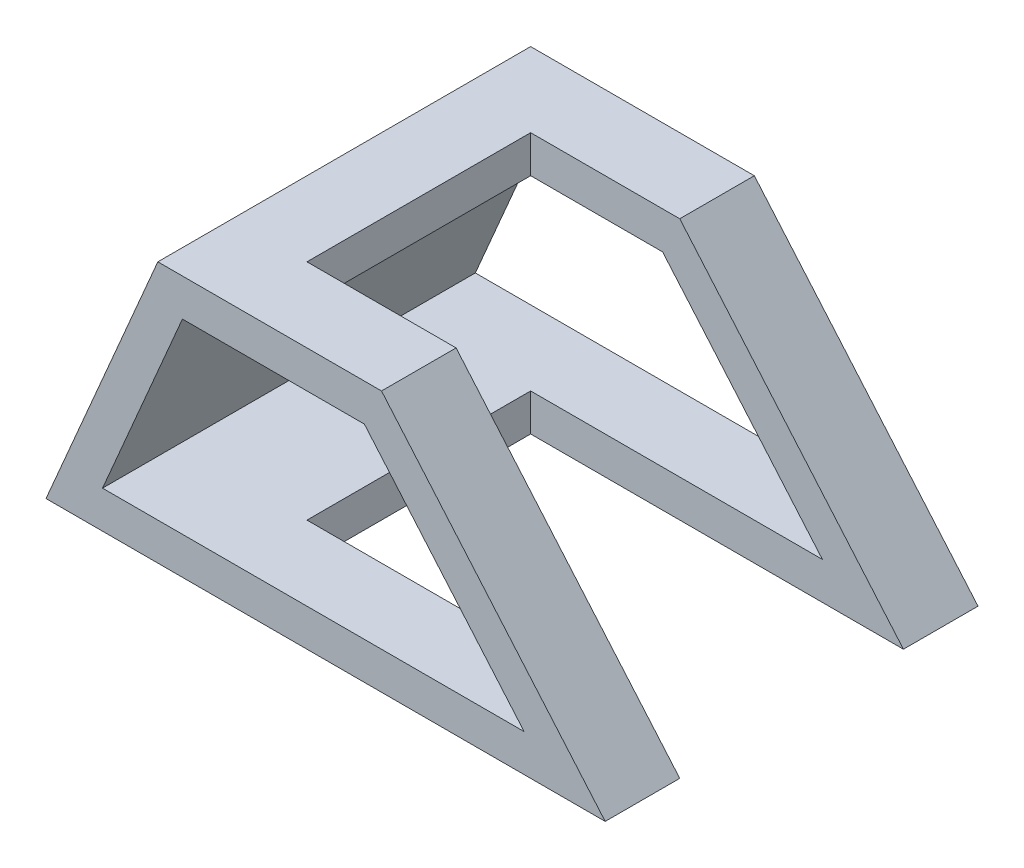
from build123d import *

# Parameters (mm, degrees)
BOSS_EXTRUDE2_DEPTH = 100
SKETCH4_W           = 40
SKETCH4_H           = 60
CUT_EXTRUDE2_DEPTH  = 100
SKETCH6_W           = 60
SKETCH6_H           = 92.195444573
CUT_EXTRUDE4_DEPTH  = 57


with BuildPart() as part:
    # Sketch1 → Boss-Extrude2 (new body)
    with BuildSketch(Plane.XY):
        Polygon((0, 0), (150, 0), (90, 70), (30, 70), align=None)
        Polygon((36.59396158, 60), (15.165390151, 10), (128.257793632, 10), (85.400650775, 60), align=None, mode=Mode.SUBTRACT)
    extrude(amount=BOSS_EXTRUDE2_DEPTH)

    # Sketch4 → Cut-Extrude2 (cut)
    with BuildSketch(Plane(origin=(0, 70, 0), x_dir=(1, 0, 0), z_dir=(0, 1, 0))):
        with Locations((70, -50)):
            Rectangle(SKETCH4_W, SKETCH4_H)
    extrude(amount=-CUT_EXTRUDE2_DEPTH, mode=Mode.SUBTRACT)

    # Sketch6 → Cut-Extrude4 (cut)
    with BuildSketch(Plane(origin=(86.470588235, 74.117647059, 0), x_dir=(0, 0, -1), z_dir=(0.7592566023652965, 0.6507913734559686, 0))):
        with Locations((-50, -51.520983732)):
            Rectangle(SKETCH6_W, SKETCH6_H)
    extrude(amount=-CUT_EXTRUDE4_DEPTH, mode=Mode.SUBTRACT)


solid = part.part
